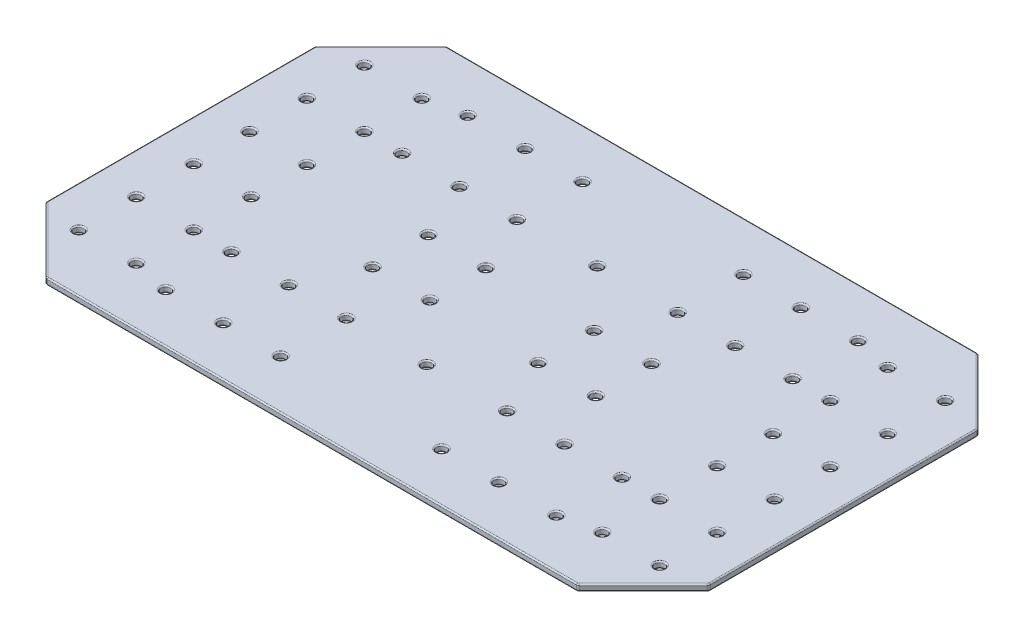
from build123d import *

# Parameters (mm, degrees)
SKETCH1_W           = 404
SKETCH1_H           = 244
SKETCH1_R           = 3
BOSS_EXTRUDE1_DEPTH = 4
SKETCH2_R           = 3
CUT_EXTRUDE1_DEPTH  = 4
SKETCH3_R           = 3
CUT_EXTRUDE2_DEPTH  = 4
CUT_EXTRUDE3_DEPTH  = 10
CUT_EXTRUDE4_DEPTH  = 10
SKETCH6_R           = 3
CUT_EXTRUDE5_DEPTH  = 10
SKETCH7_R           = 3
CUT_EXTRUDE6_DEPTH  = 10
SKETCH8_R           = 3
CUT_EXTRUDE7_DEPTH  = 10
FILLET3_R           = 2
FILLET4_R           = 2
FILLET5_R           = 2
FILLET6_R           = 2
FILLET7_R           = 2
FILLET8_R           = 2
FILLET9_R           = 2
FILLET10_R          = 2
FILLET11_R          = 0.8
FILLET12_R          = 0.8


with BuildPart() as part:
    # Sketch1 → Boss-Extrude1 (new body)
    with BuildSketch(Plane(origin=(0, 0, 0), x_dir=(1, 0, 0), z_dir=(0, 1, 0))):
        with Locations((202, -122)):
            Rectangle(SKETCH1_W, SKETCH1_H)
        with Locations(Location((118, -30, 0), (0, 0, 270))):
            Circle(SKETCH1_R, mode=Mode.SUBTRACT)
        with Locations(Location((118, -214, 0), (0, 0, 270))):
            Circle(SKETCH1_R, mode=Mode.SUBTRACT)
        with Locations(Location((286, -30, 0), (0, 0, 270))):
            Circle(SKETCH1_R, mode=Mode.SUBTRACT)
        with Locations(Location((286, -214, 0), (0, 0, 270))):
            Circle(SKETCH1_R, mode=Mode.SUBTRACT)
        with Locations(Location((118, -70, 0), (0, 0, 270))):
            Circle(SKETCH1_R, mode=Mode.SUBTRACT)
        with Locations(Location((118, -174, 0), (0, 0, 270))):
            Circle(SKETCH1_R, mode=Mode.SUBTRACT)
        with Locations(Location((286, -70, 0), (0, 0, 270))):
            Circle(SKETCH1_R, mode=Mode.SUBTRACT)
        with Locations(Location((286, -174, 0), (0, 0, 270))):
            Circle(SKETCH1_R, mode=Mode.SUBTRACT)
        with Locations(Location((321, -30, 0), (0, 0, 270))):
            Circle(SKETCH1_R, mode=Mode.SUBTRACT)
        with Locations(Location((321, -70, 0), (0, 0, 270))):
            Circle(SKETCH1_R, mode=Mode.SUBTRACT)
        with Locations(Location((321, -174, 0), (0, 0, 270))):
            Circle(SKETCH1_R, mode=Mode.SUBTRACT)
        with Locations(Location((83, -214, 0), (0, 0, 270))):
            Circle(SKETCH1_R, mode=Mode.SUBTRACT)
        with Locations(Location((83, -174, 0), (0, 0, 270))):
            Circle(SKETCH1_R, mode=Mode.SUBTRACT)
        with Locations(Location((83, -70, 0), (0, 0, 270))):
            Circle(SKETCH1_R, mode=Mode.SUBTRACT)
        with Locations(Location((83, -30, 0), (0, 0, 270))):
            Circle(SKETCH1_R, mode=Mode.SUBTRACT)
        with Locations(Location((321, -214, 0), (0, 0, 270))):
            Circle(SKETCH1_R, mode=Mode.SUBTRACT)
    extrude(amount=BOSS_EXTRUDE1_DEPTH)

    # Sketch2 → Cut-Extrude1 (cut)
    with BuildSketch(Plane(origin=(0, 4, 0), x_dir=(1, 0, 0), z_dir=(0, 1, 0))):
        with Locations(Location((153, -30, 0), (0, 0, 270))):
            Circle(SKETCH2_R)
        with Locations(Location((153, -70, 0), (0, 0, 270))):
            Circle(SKETCH2_R)
        with Locations(Location((251, -30, 0), (0, 0, 270))):
            Circle(SKETCH2_R)
        with Locations(Location((251, -70, 0), (0, 0, 270))):
            Circle(SKETCH2_R)
    extrude(amount=-CUT_EXTRUDE1_DEPTH, mode=Mode.SUBTRACT)

    # Sketch3 → Cut-Extrude2 (cut)
    with BuildSketch(Plane(origin=(0, 4, 0), x_dir=(1, 0, 0), z_dir=(0, 1, 0))):
        with Locations(Location((153, -174, 0), (0, 0, 270))):
            Circle(SKETCH3_R)
        with Locations(Location((153, -214, 0), (0, 0, 270))):
            Circle(SKETCH3_R)
        with Locations(Location((251, -174, 0), (0, 0, 270))):
            Circle(SKETCH3_R)
        with Locations(Location((251, -214, 0), (0, 0, 270))):
            Circle(SKETCH3_R)
    extrude(amount=-CUT_EXTRUDE2_DEPTH, mode=Mode.SUBTRACT)

    # Sketch4 → Cut-Extrude3 (cut)
    with BuildSketch(Plane(origin=(0, 4, 0), x_dir=(1, 0, 0), z_dir=(0, 1, 0))):
        Polygon((40, 0), (0, -40), (-46.125836583, -2.992456502), (13.987768055, 26.012231945), align=None)
        Polygon((0, -204), (40, -244), (24.706623521, -266.672188796), (-53.160874036, -255.027151211), (-20.180147391, -206.133745484), align=None)
    extrude(amount=-CUT_EXTRUDE3_DEPTH, mode=Mode.SUBTRACT)

    # Sketch5 → Cut-Extrude4 (cut)
    with BuildSketch(Plane.XZ):
        Polygon((364, 244), (404, 204), (459.252366365, 174.053371096), (447.706678113, 59.483348925), (404, 40), (364, 0), (446.984634311, -16.187456266), (481.292416175, 67.758137539), (498.414348955, 241.064910099), (405.492317156, 260.909061782), align=None)
    extrude(amount=-CUT_EXTRUDE4_DEPTH, mode=Mode.SUBTRACT)

    # Sketch6 → Cut-Extrude5 (cut)
    with BuildSketch(Plane.XZ):
        with Locations(Location((60, 209, 0), (0, 0, 270))):
            Circle(SKETCH6_R)
        with Locations(Location((60, 174, 0), (0, 0, 270))):
            Circle(SKETCH6_R)
        with Locations(Location((25, 174, 0), (0, 0, 270))):
            Circle(SKETCH6_R)
        with Locations(Location((25, 209, 0), (0, 0, 270))):
            Circle(SKETCH6_R)
        with Locations(Location((25, 70, 0), (0, 0, 270))):
            Circle(SKETCH6_R)
        with Locations(Location((60, 70, 0), (0, 0, 270))):
            Circle(SKETCH6_R)
        with Locations(Location((60, 35, 0), (0, 0, 270))):
            Circle(SKETCH6_R)
        with Locations(Location((25, 35, 0), (0, 0, 270))):
            Circle(SKETCH6_R)
        with Locations(Location((344, 209, 0), (0, 0, 270))):
            Circle(SKETCH6_R)
        with Locations(Location((379, 209, 0), (0, 0, 270))):
            Circle(SKETCH6_R)
        with Locations(Location((344, 174, 0), (0, 0, 270))):
            Circle(SKETCH6_R)
        with Locations(Location((379, 174, 0), (0, 0, 270))):
            Circle(SKETCH6_R)
        with Locations(Location((344, 70, 0), (0, 0, 270))):
            Circle(SKETCH6_R)
        with Locations(Location((379, 70, 0), (0, 0, 270))):
            Circle(SKETCH6_R)
        with Locations(Location((379, 35, 0), (0, 0, 270))):
            Circle(SKETCH6_R)
        with Locations(Location((344, 35, 0), (0, 0, 270))):
            Circle(SKETCH6_R)
    extrude(amount=-CUT_EXTRUDE5_DEPTH, mode=Mode.SUBTRACT)

    # Sketch7 → Cut-Extrude6 (cut)
    with BuildSketch(Plane.XZ):
        with Locations(Location((25, 139, 0), (0, 0, 270))):
            Circle(SKETCH7_R)
        with Locations(Location((60, 139, 0), (0, 0, 270))):
            Circle(SKETCH7_R)
        with Locations(Location((25, 105, 0), (0, 0, 270))):
            Circle(SKETCH7_R)
        with Locations(Location((60, 105, 0), (0, 0, 270))):
            Circle(SKETCH7_R)
        with Locations(Location((344, 139, 0), (0, 0, 270))):
            Circle(SKETCH7_R)
        with Locations(Location((379, 139, 0), (0, 0, 270))):
            Circle(SKETCH7_R)
        with Locations(Location((379, 105, 0), (0, 0, 270))):
            Circle(SKETCH7_R)
        with Locations(Location((344, 105, 0), (0, 0, 270))):
            Circle(SKETCH7_R)
    extrude(amount=-CUT_EXTRUDE6_DEPTH, mode=Mode.SUBTRACT)

    # Sketch8 → Cut-Extrude7 (cut)
    with BuildSketch(Plane.XZ):
        with Locations(Location((134, 139, 0), (0, 0, 270))):
            Circle(SKETCH8_R)
        with Locations(Location((169, 139, 0), (0, 0, 270))):
            Circle(SKETCH8_R)
        with Locations(Location((169, 105, 0), (0, 0, 270))):
            Circle(SKETCH8_R)
        with Locations(Location((134, 105, 0), (0, 0, 270))):
            Circle(SKETCH8_R)
        with Locations(Location((235, 139, 0), (0, 0, 270))):
            Circle(SKETCH8_R)
        with Locations(Location((270, 139, 0), (0, 0, 270))):
            Circle(SKETCH8_R)
        with Locations(Location((270, 105, 0), (0, 0, 270))):
            Circle(SKETCH8_R)
        with Locations(Location((235, 105, 0), (0, 0, 270))):
            Circle(SKETCH8_R)
        with Locations(Location((202, 174, 0), (0, 0, 270))):
            Circle(SKETCH8_R)
        with Locations(Location((202, 70, 0), (0, 0, 270))):
            Circle(SKETCH8_R)
    extrude(amount=-CUT_EXTRUDE7_DEPTH, mode=Mode.SUBTRACT)

    # Fillet3
    fillet3_edges = [part.edges().sort_by_distance(p)[0] for p in [
        (0, 2, 204),
    ]]
    fillet(fillet3_edges, radius=FILLET3_R)

    # Fillet4
    fillet4_edges = [part.edges().sort_by_distance(p)[0] for p in [
        (40, 2, 244),
    ]]
    fillet(fillet4_edges, radius=FILLET4_R)

    # Fillet5
    fillet5_edges = [part.edges().sort_by_distance(p)[0] for p in [
        (0, 2, 40),
    ]]
    fillet(fillet5_edges, radius=FILLET5_R)

    # Fillet6
    fillet6_edges = [part.edges().sort_by_distance(p)[0] for p in [
        (40, 2, 0),
    ]]
    fillet(fillet6_edges, radius=FILLET6_R)

    # Fillet7
    fillet7_edges = [part.edges().sort_by_distance(p)[0] for p in [
        (364, 2, 0),
    ]]
    fillet(fillet7_edges, radius=FILLET7_R)

    # Fillet8
    fillet8_edges = [part.edges().sort_by_distance(p)[0] for p in [
        (404, 2, 40),
    ]]
    fillet(fillet8_edges, radius=FILLET8_R)

    # Fillet9
    fillet9_edges = [part.edges().sort_by_distance(p)[0] for p in [
        (364, 2, 244),
    ]]
    fillet(fillet9_edges, radius=FILLET9_R)

    # Fillet10
    fillet10_edges = [part.edges().sort_by_distance(p)[0] for p in [
        (404, 2, 204),
    ]]
    fillet(fillet10_edges, radius=FILLET10_R)

    # Fillet11
    fillet11_edges = [part.edges().sort_by_distance(p)[0] for p in [
        (251, 0, 27),
        (251, 0, 67),
        (153, 0, 27),
        (153, 0, 211),
        (251, 0, 171),
        (251, 0, 211),
        (153, 0, 171),
        (118, 0, 27),
        (118, 0, 211),
        (286, 0, 27),
        (286, 0, 211),
        (118, 0, 67),
        (60, 0, 73),
        (60, 0, 38),
        (25, 0, 38),
        (344, 0, 212),
        (60, 0, 177),
        (25, 0, 177),
        (25, 0, 212),
        (25, 0, 73),
        (344, 0, 38),
        (379, 0, 38),
        (379, 0, 73),
        (379, 0, 212),
        (344, 0, 177),
        (379, 0, 177),
        (344, 0, 73),
        (118, 0, 171),
        (60, 0, 212),
        (286, 0, 67),
        (344, 0, 142),
        (60, 0, 108),
        (25, 0, 108),
        (60, 0, 142),
        (286, 0, 171),
        (379, 0, 142),
        (379, 0, 108),
        (344, 0, 108),
        (25, 0, 142),
        (321, 0, 27),
        (202, 0, 73),
        (235, 0, 142),
        (134, 0, 108),
        (321, 0, 67),
        (169, 0, 108),
        (169, 0, 142),
        (270, 0, 142),
        (270, 0, 108),
        (235, 0, 108),
        (202, 0, 177),
        (134, 0, 142),
        (321, 0, 171),
        (0.152240935, 0, 203.93693974),
        (202, 0, 244),
        (20, 0, 224),
        (40.06306026, 0, 243.847759065),
        (0, 0, 122),
        (20, 0, 20),
        (0.152240935, 0, 40.06306026),
        (321, 0, 211),
        (40.06306026, 0, 0.152240935),
        (202, 0, 0),
        (363.93693974, 0, 0.152240935),
        (384, 0, 20),
        (403.847759065, 0, 40.06306026),
        (83, 0, 211),
        (384, 0, 224),
        (363.93693974, 0, 243.847759065),
        (404, 0, 122),
        (403.847759065, 0, 203.93693974),
        (83, 0, 171),
        (83, 0, 67),
        (83, 0, 27),
        (153, 0, 67),
    ]]
    fillet(fillet11_edges, radius=FILLET11_R)

    # Fillet12
    fillet12_edges = [part.edges().sort_by_distance(p)[0] for p in [
        (251, 4, 27),
        (251, 4, 67),
        (153, 4, 27),
        (153, 4, 211),
        (251, 4, 171),
        (251, 4, 211),
        (153, 4, 171),
        (118, 4, 27),
        (118, 4, 211),
        (286, 4, 27),
        (286, 4, 211),
        (118, 4, 67),
        (60, 4, 73),
        (60, 4, 38),
        (25, 4, 38),
        (344, 4, 212),
        (60, 4, 177),
        (25, 4, 177),
        (25, 4, 212),
        (25, 4, 73),
        (344, 4, 38),
        (379, 4, 38),
        (379, 4, 73),
        (379, 4, 212),
        (344, 4, 177),
        (379, 4, 177),
        (344, 4, 73),
        (60, 4, 212),
        (118, 4, 171),
        (286, 4, 67),
        (344, 4, 142),
        (60, 4, 108),
        (25, 4, 108),
        (60, 4, 142),
        (379, 4, 142),
        (286, 4, 171),
        (379, 4, 108),
        (344, 4, 108),
        (25, 4, 142),
        (321, 4, 27),
        (202, 4, 73),
        (235, 4, 142),
        (134, 4, 108),
        (169, 4, 108),
        (321, 4, 67),
        (169, 4, 142),
        (270, 4, 142),
        (270, 4, 108),
        (235, 4, 108),
        (202, 4, 177),
        (134, 4, 142),
        (321, 4, 171),
        (0.152240935, 4, 203.93693974),
        (202, 4, 244),
        (20, 4, 224),
        (40.06306026, 4, 243.847759065),
        (0, 4, 122),
        (20, 4, 20),
        (0.152240935, 4, 40.06306026),
        (321, 4, 211),
        (40.06306026, 4, 0.152240935),
        (202, 4, 0),
        (384, 4, 20),
        (363.93693974, 4, 0.152240935),
        (403.847759065, 4, 40.06306026),
        (83, 4, 211),
        (363.93693974, 4, 243.847759065),
        (404, 4, 122),
        (384, 4, 224),
        (403.847759065, 4, 203.93693974),
        (83, 4, 171),
        (83, 4, 67),
        (83, 4, 27),
        (153, 4, 67),
    ]]
    fillet(fillet12_edges, radius=FILLET12_R)


solid = part.part
